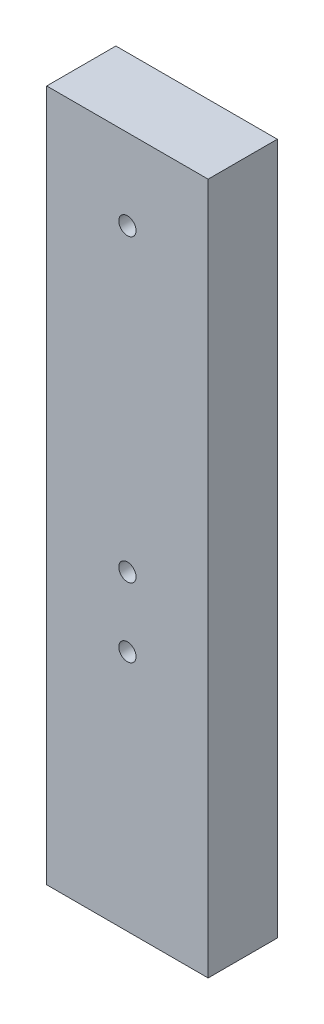
from build123d import *

# Parameters (mm, degrees)
SKETCH1_W           = 88.9
SKETCH1_H           = 381
BOSS_EXTRUDE1_DEPTH = 38.1
SKETCH2_R           = 4.7625
CUT_EXTRUDE1_DEPTH  = 394.08500353
SKETCH3_R           = 4.7625
CUT_EXTRUDE2_DEPTH  = 394.08500353
SKETCH4_R           = 4.7625
CUT_EXTRUDE3_DEPTH  = 394.08500353


with BuildPart() as part:
    # Sketch1 → Boss-Extrude1 (new body)
    with BuildSketch(Plane.XY):
        with Locations((44.45, 190.5)):
            Rectangle(SKETCH1_W, SKETCH1_H)
    extrude(amount=BOSS_EXTRUDE1_DEPTH)

    # Sketch2 → Cut-Extrude1 (cut, through all)
    with BuildSketch(Plane.XY.offset(38.1)):
        with Locations((44.45, 133.35)):
            Circle(SKETCH2_R)
    extrude(amount=-CUT_EXTRUDE1_DEPTH, mode=Mode.SUBTRACT)

    # Sketch3 → Cut-Extrude2 (cut, through all)
    with BuildSketch(Plane.XY.offset(38.1)):
        with Locations((44.45, 336.55)):
            Circle(SKETCH3_R)
    extrude(amount=-CUT_EXTRUDE2_DEPTH, mode=Mode.SUBTRACT)

    # Sketch4 → Cut-Extrude3 (cut, through all)
    with BuildSketch(Plane.XY.offset(38.1)):
        with Locations((44.45, 171.45)):
            Circle(SKETCH4_R)
    extrude(amount=-CUT_EXTRUDE3_DEPTH, mode=Mode.SUBTRACT)


solid = part.part
